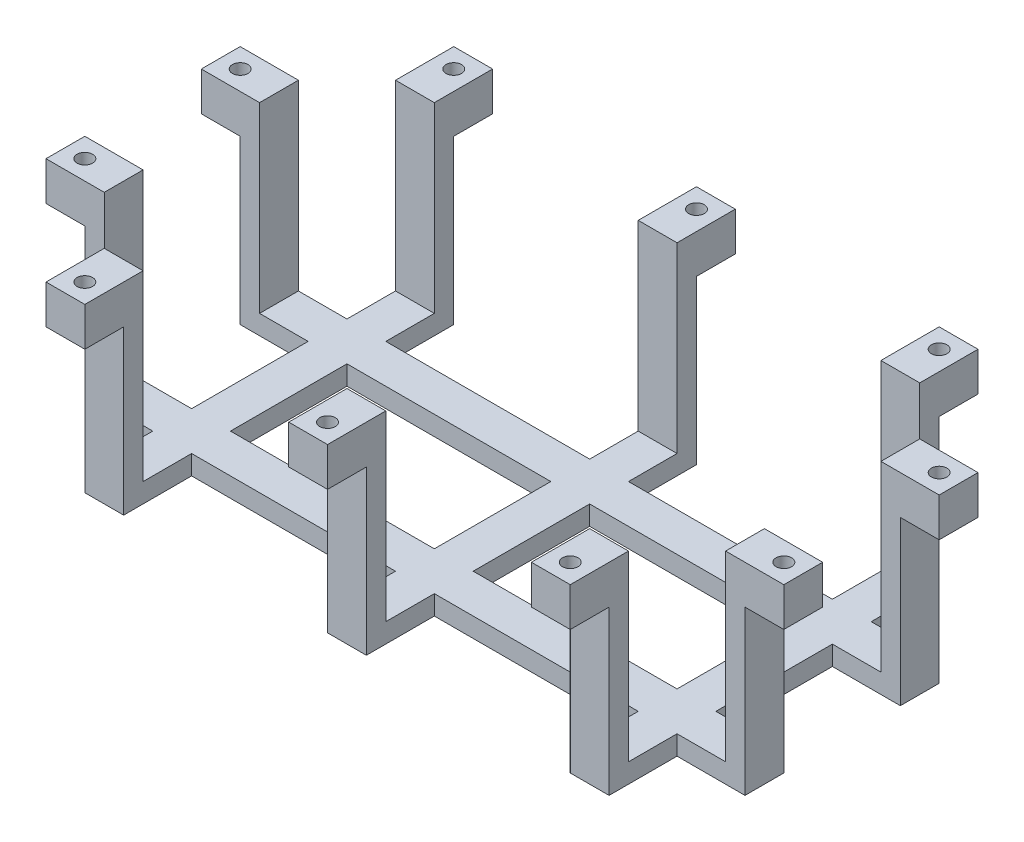
from build123d import *

# Parameters (mm, degrees)
SKETCH2_W           = 52.5
SKETCH2_H           = 10
SKETCH2_W_2         = 10
SKETCH2_H_2         = 30
SKETCH2_H_3         = 12.5
SKETCH2_W_3         = 12.5
BOSS_EXTRUDE1_DEPTH = 5
SKETCH2_4_W         = 10
SKETCH2_4_H         = 5
SKETCH2_4_W_2       = 5
SKETCH2_4_H_2       = 10
BOSS_EXTRUDE2_DEPTH = 52
SKETCH2_5_W         = 10
SKETCH2_5_H         = 10
BOSS_EXTRUDE3_DEPTH = 52
SKETCH2_6_W         = 10
SKETCH2_6_H         = 10
CUT_EXTRUDE1_DEPTH  = 42
SKETCH3_R           = 2
CUT_EXTRUDE2_DEPTH  = 10


with BuildPart() as part:
    # Sketch2 → Boss-Extrude1 (new body)
    with BuildSketch(Plane(origin=(0, 0, 0), x_dir=(1, 0, 0), z_dir=(0, 1, 0))):
        with Locations((-31.25, 20)):
            Rectangle(SKETCH2_W, SKETCH2_H)
        with Locations((-62.5, 20)):
            Rectangle(SKETCH2_W_2, SKETCH2_H)
        with Locations((-62.5, 0)):
            Rectangle(SKETCH2_W_2, SKETCH2_H_2)
        Rectangle(SKETCH2_W_2, SKETCH2_H_2)
        with Locations((0, 20)):
            Rectangle(SKETCH2_W_2, SKETCH2_H)
        with Locations((-31.25, -20)):
            Rectangle(SKETCH2_W, SKETCH2_H)
        with Locations((0, -20)):
            Rectangle(SKETCH2_W_2, SKETCH2_H)
        with Locations((-62.5, -20)):
            Rectangle(SKETCH2_W_2, SKETCH2_H)
        with Locations((31.25, -20)):
            Rectangle(SKETCH2_W, SKETCH2_H)
        with Locations((31.25, 20)):
            Rectangle(SKETCH2_W, SKETCH2_H)
        with Locations((62.5, 0)):
            Rectangle(SKETCH2_W_2, SKETCH2_H_2)
        with Locations((62.5, 20)):
            Rectangle(SKETCH2_W_2, SKETCH2_H)
        with Locations((62.5, -20)):
            Rectangle(SKETCH2_W_2, SKETCH2_H)
        with Locations((0, -31.25)):
            Rectangle(SKETCH2_W_2, SKETCH2_H_3)
        with Locations((62.5, -31.25)):
            Rectangle(SKETCH2_W_2, SKETCH2_H_3)
        with Locations((73.75, -20)):
            Rectangle(SKETCH2_W_3, SKETCH2_H)
        with Locations((73.75, 20)):
            Rectangle(SKETCH2_W_3, SKETCH2_H)
        with Locations((0, 31.25)):
            Rectangle(SKETCH2_W_2, SKETCH2_H_3)
        with Locations((62.5, 31.25)):
            Rectangle(SKETCH2_W_2, SKETCH2_H_3)
        with Locations((-62.5, 31.25)):
            Rectangle(SKETCH2_W_2, SKETCH2_H_3)
        with Locations((-73.75, 20)):
            Rectangle(SKETCH2_W_3, SKETCH2_H)
        with Locations((-73.75, -20)):
            Rectangle(SKETCH2_W_3, SKETCH2_H)
        with Locations((-62.5, -31.25)):
            Rectangle(SKETCH2_W_2, SKETCH2_H_3)
    extrude(amount=BOSS_EXTRUDE1_DEPTH)

    # Sketch2<4> → Boss-Extrude2 (add)
    with BuildSketch(Plane(origin=(0, 0, 0), x_dir=(1, 0, 0), z_dir=(0, 1, 0))):
        with Locations((-62.5, -40)):
            Rectangle(SKETCH2_4_W, SKETCH2_4_H)
        with Locations((0, -40)):
            Rectangle(SKETCH2_4_W, SKETCH2_4_H)
        with Locations((62.5, -40)):
            Rectangle(SKETCH2_4_W, SKETCH2_4_H)
        with Locations((82.5, -20)):
            Rectangle(SKETCH2_4_W_2, SKETCH2_4_H_2)
        with Locations((82.5, 20)):
            Rectangle(SKETCH2_4_W_2, SKETCH2_4_H_2)
        with Locations((62.5, 40)):
            Rectangle(SKETCH2_4_W, SKETCH2_4_H)
        with Locations((0, 40)):
            Rectangle(SKETCH2_4_W, SKETCH2_4_H)
        with Locations((-62.5, 40)):
            Rectangle(SKETCH2_4_W, SKETCH2_4_H)
        with Locations((-82.5, 20)):
            Rectangle(SKETCH2_4_W_2, SKETCH2_4_H_2)
        with Locations((-82.5, -20)):
            Rectangle(SKETCH2_4_W_2, SKETCH2_4_H_2)
    extrude(amount=BOSS_EXTRUDE2_DEPTH)

    # Sketch2<5> → Boss-Extrude3 (add)
    with BuildSketch(Plane(origin=(0, 0, 0), x_dir=(1, 0, 0), z_dir=(0, 1, 0))):
        with Locations((-62.5, -47.5)):
            Rectangle(SKETCH2_5_W, SKETCH2_5_H)
        with Locations((-90, -20)):
            Rectangle(SKETCH2_5_W, SKETCH2_5_H)
        with Locations((-90, 20)):
            Rectangle(SKETCH2_5_W, SKETCH2_5_H)
        with Locations((-62.5, 47.5)):
            Rectangle(SKETCH2_5_W, SKETCH2_5_H)
        with Locations((0, 47.5)):
            Rectangle(SKETCH2_5_W, SKETCH2_5_H)
        with Locations((62.5, 47.5)):
            Rectangle(SKETCH2_5_W, SKETCH2_5_H)
        with Locations((90, 20)):
            Rectangle(SKETCH2_5_W, SKETCH2_5_H)
        with Locations((90, -20)):
            Rectangle(SKETCH2_5_W, SKETCH2_5_H)
        with Locations((62.5, -47.5)):
            Rectangle(SKETCH2_5_W, SKETCH2_5_H)
        with Locations((0, -47.5)):
            Rectangle(SKETCH2_5_W, SKETCH2_5_H)
    extrude(amount=BOSS_EXTRUDE3_DEPTH)

    # Sketch2<6> → Cut-Extrude1 (cut)
    with BuildSketch(Plane(origin=(0, 0, 0), x_dir=(1, 0, 0), z_dir=(0, 1, 0))):
        with Locations((-62.5, -47.5)):
            Rectangle(SKETCH2_6_W, SKETCH2_6_H)
        with Locations((-90, -20)):
            Rectangle(SKETCH2_6_W, SKETCH2_6_H)
        with Locations((-90, 20)):
            Rectangle(SKETCH2_6_W, SKETCH2_6_H)
        with Locations((-62.5, 47.5)):
            Rectangle(SKETCH2_6_W, SKETCH2_6_H)
        with Locations((0, 47.5)):
            Rectangle(SKETCH2_6_W, SKETCH2_6_H)
        with Locations((62.5, 47.5)):
            Rectangle(SKETCH2_6_W, SKETCH2_6_H)
        with Locations((90, 20)):
            Rectangle(SKETCH2_6_W, SKETCH2_6_H)
        with Locations((90, -20)):
            Rectangle(SKETCH2_6_W, SKETCH2_6_H)
        with Locations((62.5, -47.5)):
            Rectangle(SKETCH2_6_W, SKETCH2_6_H)
        with Locations((0, -47.5)):
            Rectangle(SKETCH2_6_W, SKETCH2_6_H)
    extrude(amount=CUT_EXTRUDE1_DEPTH, mode=Mode.SUBTRACT)

    # Sketch3 → Cut-Extrude2 (cut)
    with BuildSketch(Plane.XZ.offset(-42)):
        with Locations(Location((-62.5, -47.5, 0), (0, 0, 270))):
            Circle(SKETCH3_R)
        with Locations(Location((-90, -20, 0), (0, 0, 270))):
            Circle(SKETCH3_R)
        with Locations(Location((0, -47.5, 0), (0, 0, 270))):
            Circle(SKETCH3_R)
        with Locations(Location((62.5, -47.5, 0), (0, 0, 270))):
            Circle(SKETCH3_R)
        with Locations(Location((90, -20, 0), (0, 0, 270))):
            Circle(SKETCH3_R)
        with Locations(Location((90, 20, 0), (0, 0, 270))):
            Circle(SKETCH3_R)
        with Locations(Location((62.5, 47.5, 0), (0, 0, 270))):
            Circle(SKETCH3_R)
        with Locations(Location((0, 47.5, 0), (0, 0, 270))):
            Circle(SKETCH3_R)
        with Locations(Location((-90, 20, 0), (0, 0, 270))):
            Circle(SKETCH3_R)
        with Locations(Location((-62.5, 47.5, 0), (0, 0, 270))):
            Circle(SKETCH3_R)
    extrude(amount=-CUT_EXTRUDE2_DEPTH, mode=Mode.SUBTRACT)


solid = part.part
